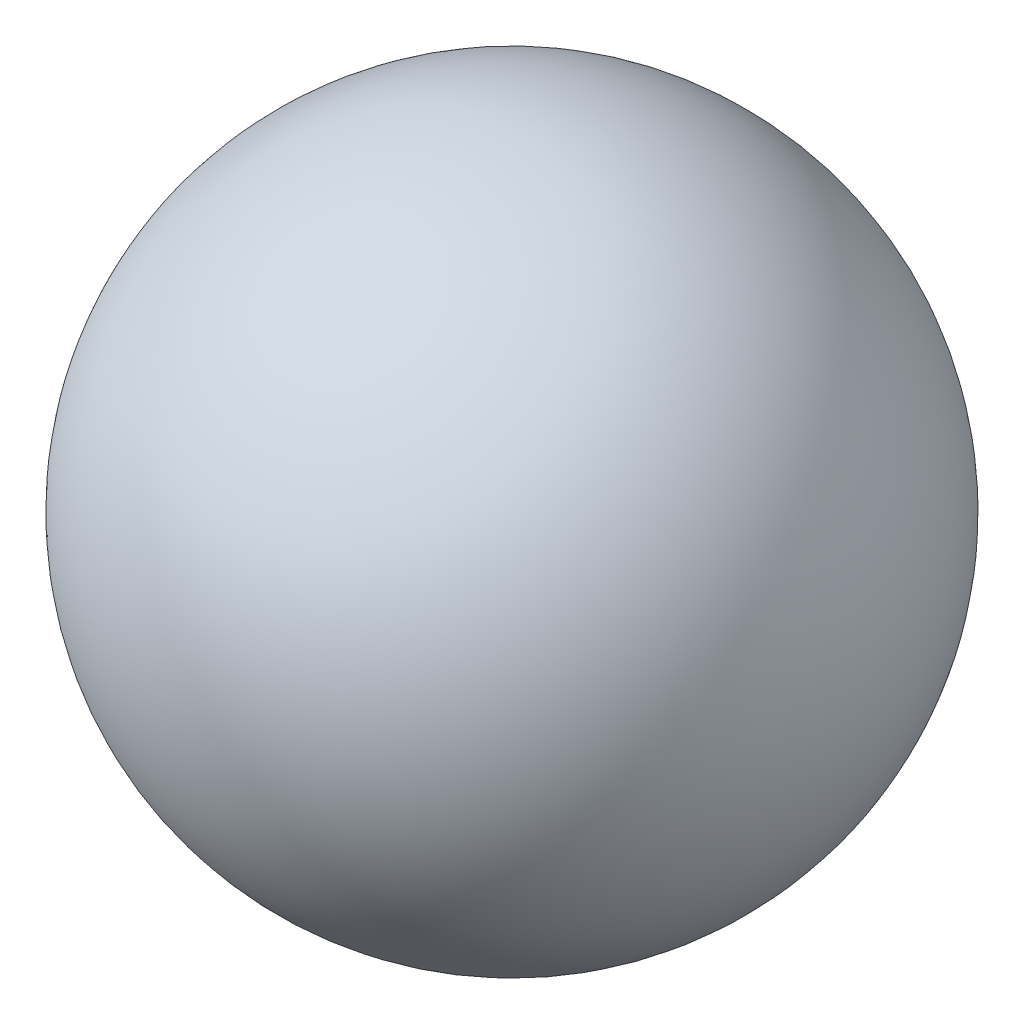
from build123d import *


with BuildPart() as part:
    # Esquisse1 → Révolution1 (revolve)
    with BuildSketch(Plane.XY):
        with BuildLine():
            Line((-12, 0), (12, 0))
            ThreePointArc((12, 0), (0, -12), (-12, 0))
        make_face()
    revolve(axis=Axis((-12, 0, 0), (1, 0, 0)))


solid = part.part
